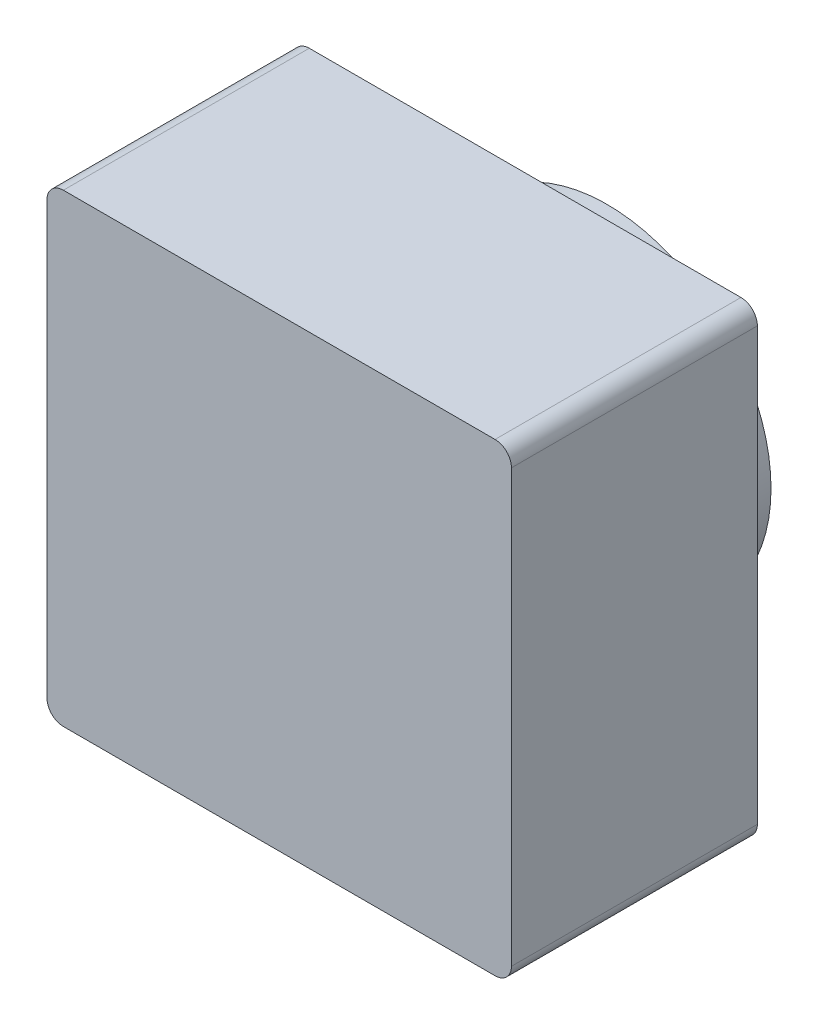
from build123d import *

# Parameters (mm, degrees)
BODY_DEPTH = 4.5
LENS_SK2_R = 3
LENS_DEPTH = 1.5


with BuildPart() as part:
    # Body_Sk1 → Body (new body)
    with BuildSketch(Plane.XY.offset(-10.2)):
        with BuildLine():
            Line((-20.31, 5.69), (-12.41, 5.69))
            ThreePointArc((-12.41, 5.69), (-12.197867966, 5.777867966), (-12.11, 5.99))
            Line((-12.11, 5.99), (-12.11, 13.89))
            ThreePointArc((-12.11, 13.89), (-12.197867966, 14.102132034), (-12.41, 14.19))
            Line((-12.41, 14.19), (-20.31, 14.19))
            ThreePointArc((-20.31, 14.19), (-20.522132034, 14.102132034), (-20.61, 13.89))
            Line((-20.61, 13.89), (-20.61, 5.99))
            ThreePointArc((-20.61, 5.99), (-20.522132034, 5.777867966), (-20.31, 5.69))
        make_face()
    extrude(amount=-BODY_DEPTH)

    # Lens_Sk2 → Lens (add)
    with BuildSketch(Plane.XY.offset(-14.7)):
        with Locations((-16.36, 9.94)):
            Circle(LENS_SK2_R)
    extrude(amount=-LENS_DEPTH)


solid = part.part
